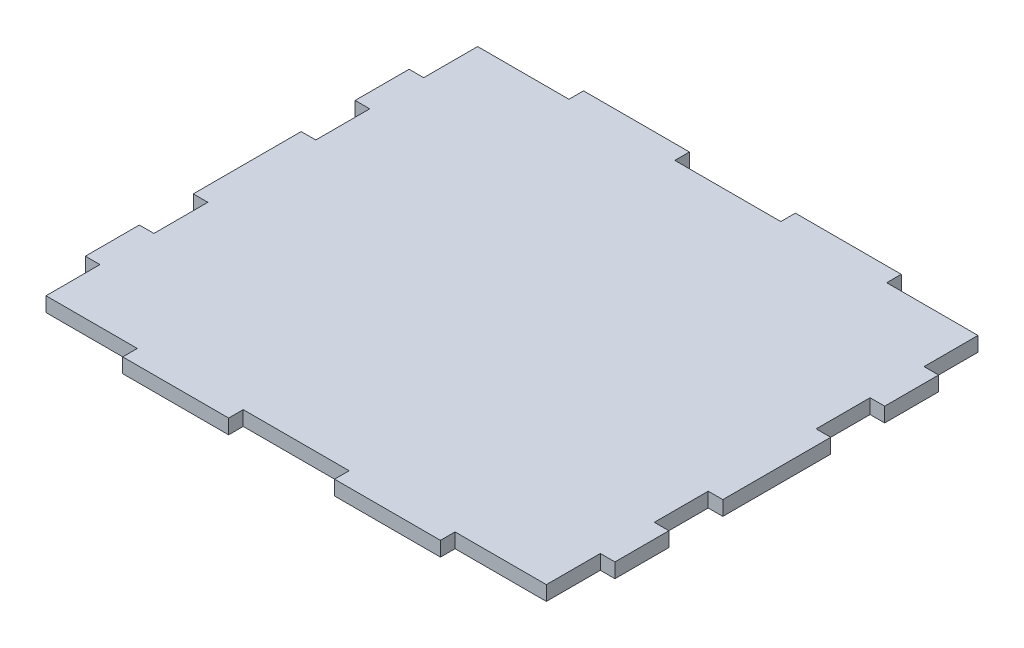
from build123d import *

# Parameters (mm, degrees)
SKETCH1_W           = 354.00488
SKETCH1_H           = 308.0512
BOSS_EXTRUDE1_DEPTH = 9.7536
SKETCH2_W           = 9.7536
SKETCH2_H           = 36.068
SKETCH2_W_2         = 35.400488
SKETCH2_H_2         = 9.7536
SKETCH2_W_3         = 70.800976
CUT_EXTRUDE1_DEPTH  = 337.60815813


with BuildPart() as part:
    # Sketch1 → Boss-Extrude1 (new body)
    with BuildSketch(Plane(origin=(0, 0, 0), x_dir=(1, 0, 0), z_dir=(0, 1, 0))):
        with Locations((-22.236704585, -117.108467707)):
            Rectangle(SKETCH1_W, SKETCH1_H)
    extrude(amount=BOSS_EXTRUDE1_DEPTH)

    # Sketch2 → Cut-Extrude1 (cut, through all)
    with BuildSketch(Plane(origin=(0, 9.7536, 0), x_dir=(1, 0, 0), z_dir=(0, 1, 0))):
        with Locations((-194.362344585, -171.210467707)):
            Rectangle(SKETCH2_W, SKETCH2_H)
        with Locations((-194.362344585, -243.346467707)):
            Rectangle(SKETCH2_W, SKETCH2_H)
        Polygon((-199.239144585, -271.134067707), (-128.438168585, -271.134067707), (-128.438168585, -261.380467707), (-189.485544585, -261.380467707), (-199.239144585, -261.380467707), align=None)
        with Locations((-4.536460585, -266.257267707)):
            Rectangle(SKETCH2_W_2, SKETCH2_H_2)
        with Locations((-39.936948585, -266.257267707)):
            Rectangle(SKETCH2_W_2, SKETCH2_H_2)
        with Locations((119.365247415, -266.257267707)):
            Rectangle(SKETCH2_W_3, SKETCH2_H_2)
        with Locations((149.888935415, -243.346467707)):
            Rectangle(SKETCH2_W, SKETCH2_H)
        with Locations((149.888935415, -171.210467707)):
            Rectangle(SKETCH2_W, SKETCH2_H)
        with Locations((149.888935415, -63.006467707)):
            Rectangle(SKETCH2_W, SKETCH2_H)
        with Locations((149.888935415, 9.129532293)):
            Rectangle(SKETCH2_W, SKETCH2_H)
        with Locations((119.365247415, 32.040332293)):
            Rectangle(SKETCH2_W_3, SKETCH2_H_2)
        with Locations((-22.236704585, 32.040332293)):
            Rectangle(SKETCH2_W_3, SKETCH2_H_2)
        with Locations((-194.362344585, -63.006467707)):
            Rectangle(SKETCH2_W, SKETCH2_H)
        with Locations((-194.362344585, 9.129532293)):
            Rectangle(SKETCH2_W, SKETCH2_H)
        with Locations((-163.838656585, 32.040332293)):
            Rectangle(SKETCH2_W_3, SKETCH2_H_2)
    extrude(amount=-CUT_EXTRUDE1_DEPTH, mode=Mode.SUBTRACT)


solid = part.part
